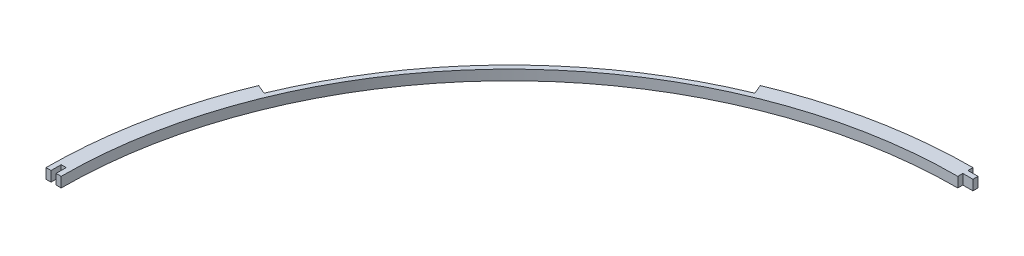
from build123d import *

# Parameters (mm, degrees)
BOSS_EXTRUDE2_DEPTH = 6.35


with BuildPart() as part:
    # Sketch1 → Boss-Extrude2 (new body)
    with BuildSketch(Plane(origin=(0, 0, 0), x_dir=(1, 0, 0), z_dir=(0, 1, 0))):
        with BuildLine():
            Line((0, 288.036), (0, 291.211))
            ThreePointArc((0, 291.211), (-56.812447765, 285.615462292), (-111.441625022, 269.043882542))
            Line((-111.441625022, 269.043882542), (-109.011585227, 263.177247511))
            ThreePointArc((-109.011585227, 263.177247511), (-55.57362422, 279.387475761), (0, 284.861))
            Line((0, 284.861), (6.35, 284.861))
            Line((6.35, 284.861), (6.35, 288.036))
            Line((6.35, 288.036), (0, 288.036))
        make_face()
        with BuildLine():
            ThreePointArc((0, 284.861), (-55.57362422, 279.387475761), (-109.011585227, 263.177247511))
            ThreePointArc((-109.011585227, 263.177247511), (-201.427144796, 201.427144796), (-263.177247511, 109.011585227))
            ThreePointArc((-263.177247511, 109.011585227), (-279.387475761, 55.57362422), (-284.861, 0))
            Line((-284.861, 0), (-281.686, 0))
            ThreePointArc((-281.686, 0), (-199.182080765, 199.182080765), (0, 281.686))
            Line((0, 281.686), (0, 284.861))
        make_face()
        with BuildLine():
            Line((-263.177247511, 109.011585227), (-269.043882542, 111.441625022))
            ThreePointArc((-269.043882542, 111.441625022), (-285.615462292, 56.812447765), (-291.211, 0))
            Line((-291.211, 0), (-288.036, 0))
            Line((-288.036, 0), (-288.036, 6.35))
            Line((-288.036, 6.35), (-284.861, 6.35))
            Line((-284.861, 6.35), (-284.861, 0))
            ThreePointArc((-284.861, 0), (-279.387475761, 55.57362422), (-263.177247511, 109.011585227))
        make_face()
    extrude(amount=BOSS_EXTRUDE2_DEPTH)


solid = part.part
